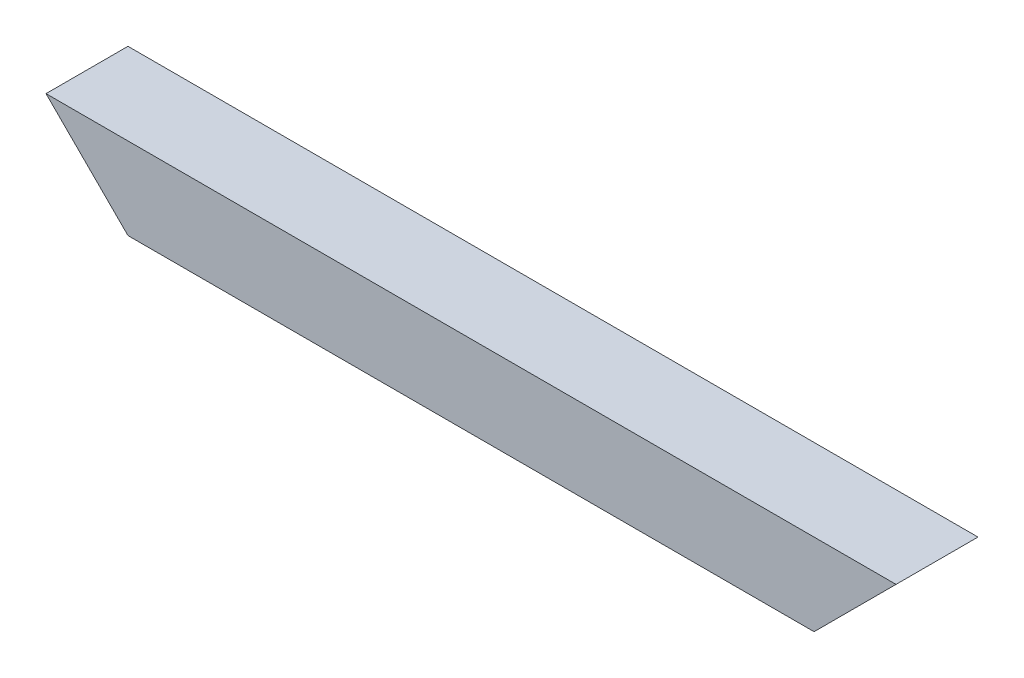
from build123d import *

# Parameters (mm, degrees)
SKETCH1_W               = 38.1
SKETCH1_H               = 38.1
BOSS_EXTRUDE1_DEPTH     = 395.1312646
CUT_EXTRUDE1_DEPTH      = 399.788084406
CUT_EXTRUDE1_DEPTH_BACK = 399.788084406
CUT_EXTRUDE2_DEPTH      = 399.788084406
CUT_EXTRUDE2_DEPTH_BACK = 399.788084406


with BuildPart() as part:
    # Sketch1 → Boss-Extrude1 (new body)
    with BuildSketch(Plane(origin=(0, 0, 0), x_dir=(0, 0, -1), z_dir=(1, 0, 0))):
        with Locations((19.05, -19.05)):
            Rectangle(SKETCH1_W, SKETCH1_H)
    extrude(amount=BOSS_EXTRUDE1_DEPTH)

    # Sketch2 → Cut-Extrude1 (cut, two sides: drawn at the far end of the back side and taken through both)
    with BuildSketch(Plane.XY.offset(-CUT_EXTRUDE1_DEPTH_BACK)):
        Polygon((-803.92777068, -38.1), (0, -38.1), (38.1, -38.1), (0, 0), (-568.462778232, 568.462778232), (-2067.342418515, 1150.321236821), (-2302.807410963, 543.758458589), align=None)
    extrude(amount=CUT_EXTRUDE1_DEPTH + CUT_EXTRUDE1_DEPTH_BACK, mode=Mode.SUBTRACT)

    # Sketch3 → Cut-Extrude2 (cut, two sides: drawn at the far end of the back side and taken through both)
    with BuildSketch(Plane.XY.offset(-CUT_EXTRUDE2_DEPTH_BACK)):
        Polygon((1199.05903528, -38.1), (395.1312646, -38.1), (357.0312646, -38.1), (395.1312646, 0), (963.594042832, 568.462778232), (2462.473683115, 1150.321236821), (2697.938675563, 543.758458589), align=None)
    extrude(amount=CUT_EXTRUDE2_DEPTH + CUT_EXTRUDE2_DEPTH_BACK, mode=Mode.SUBTRACT)


solid = part.part
